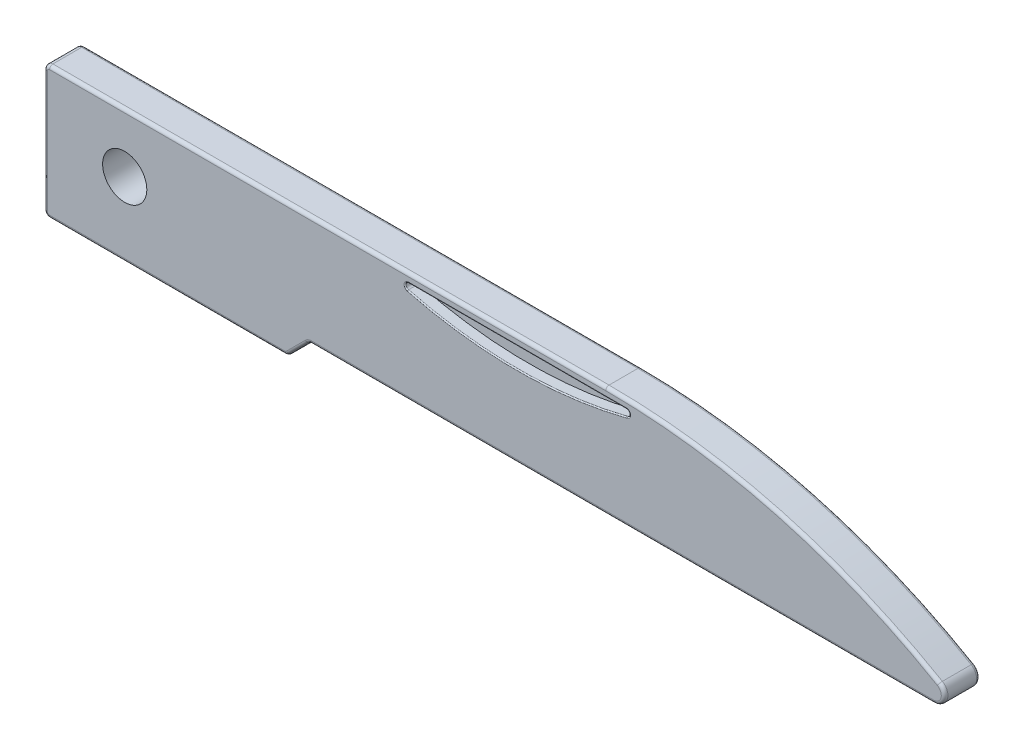
from build123d import *

# Parameters (mm, degrees)
BOSS_EXTRUDE1_DEPTH = 1.6
FILLET1_R           = 0.5
FILLET2_R           = 0.25
FILLET3_R           = 0.15
SKETCH2_R           = 1
CUT_EXTRUDE3_DEPTH  = 35.771862445
CUT_EXTRUDE4_DEPTH  = 0.5
FILLET4_R           = 0.15
FILLET5_R           = 0.05


with BuildPart() as part:
    # Sketch1 → Boss-Extrude1 (new body)
    with BuildSketch(Plane.XY):
        with BuildLine():
            Line((4.463625287, 0), (-6.536374713, 0))
            Line((-6.536374713, 0), (-6.536374713, 6))
            Line((-6.536374713, 6), (18.880501335, 6))
            ThreePointArc((18.880501335, 6), (27.540755373, 4.722813233), (35.463625287, 1))
            Line((35.463625287, 1), (5.463625287, 1))
            Line((5.463625287, 1), (4.463625287, 0))
        make_face()
    extrude(amount=BOSS_EXTRUDE1_DEPTH)

    # Fillet1
    fillet1_edges = [part.edges().sort_by_distance(p)[0] for p in [
        (35.463625287, 1, 0.8),
    ]]
    fillet(fillet1_edges, radius=FILLET1_R)

    # Fillet2
    fillet2_edges = [part.edges().sort_by_distance(p)[0] for p in [
        (4.463625287, 0, 0.8),
        (-6.536374713, 0, 0.8),
        (-6.536374713, 6, 0.8),
        (5.463625287, 1, 0.8),
    ]]
    fillet(fillet2_edges, radius=FILLET2_R)

    # Fillet3
    fillet3_edges = [part.edges().sort_by_distance(p)[0] for p in [
        (6.297063311, 6, 1.6),
        (26.691835994, 4.96520414, 0),
        (26.691835994, 4.96520414, 1.6),
        (34.195651711, 1.369811089, 0),
        (34.195651711, 1.369811089, 1.6),
        (19.640038493, 1, 0),
        (19.640038493, 1, 1.6),
        (4.963625287, 0.5, 0),
        (4.963625287, 0.5, 1.6),
        (-0.963151409, 0, 0),
        (-6.536374713, 3, 0),
        (-6.463151409, 5.926776695, 0),
        (-6.463151409, 0.073223305, 0),
        (4.455742754, 0.019030117, 0),
        (-0.963151409, 0, 1.6),
        (-6.536374713, 3, 1.6),
        (-6.463151409, 5.926776695, 1.6),
        (-6.463151409, 0.073223305, 1.6),
        (4.455742754, 0.019030117, 1.6),
        (5.471507819, 0.980969883, 0),
        (5.471507819, 0.980969883, 1.6),
        (6.297063311, 6, 0),
    ]]
    fillet(fillet3_edges, radius=FILLET3_R)

    # Sketch2 → Cut-Extrude3 (cut, through all)
    with BuildSketch(Plane.XY):
        with Locations((-2.886374713, 3.35)):
            Circle(SKETCH2_R)
    extrude(amount=CUT_EXTRUDE3_DEPTH, mode=Mode.SUBTRACT)

    # Sketch3 → Cut-Extrude4 (cut)
    with BuildSketch(Plane.XY.offset(1.6)):
        with BuildLine():
            Line((20.880501335, 5.6), (8.880501335, 5.6))
            ThreePointArc((8.880501335, 5.6), (14.880501335, 4.678784028), (20.880501335, 5.6))
        make_face()
    extrude(amount=-CUT_EXTRUDE4_DEPTH, mode=Mode.SUBTRACT)

    # Fillet4
    fillet4_edges = [part.edges().sort_by_distance(p)[0] for p in [
        (20.880501335, 5.6, 1.35),
        (8.880501335, 5.6, 1.35),
    ]]
    fillet(fillet4_edges, radius=FILLET4_R)

    # Fillet5
    fillet5_edges = [part.edges().sort_by_distance(p)[0] for p in [
        (14.880501335, 4.678784028, 1.6),
        (14.880501335, 5.6, 1.6),
        (9.804574431, 5.46876365, 1.6),
        (19.956428239, 5.46876365, 1.6),
    ]]
    fillet(fillet5_edges, radius=FILLET5_R)


solid = part.part
